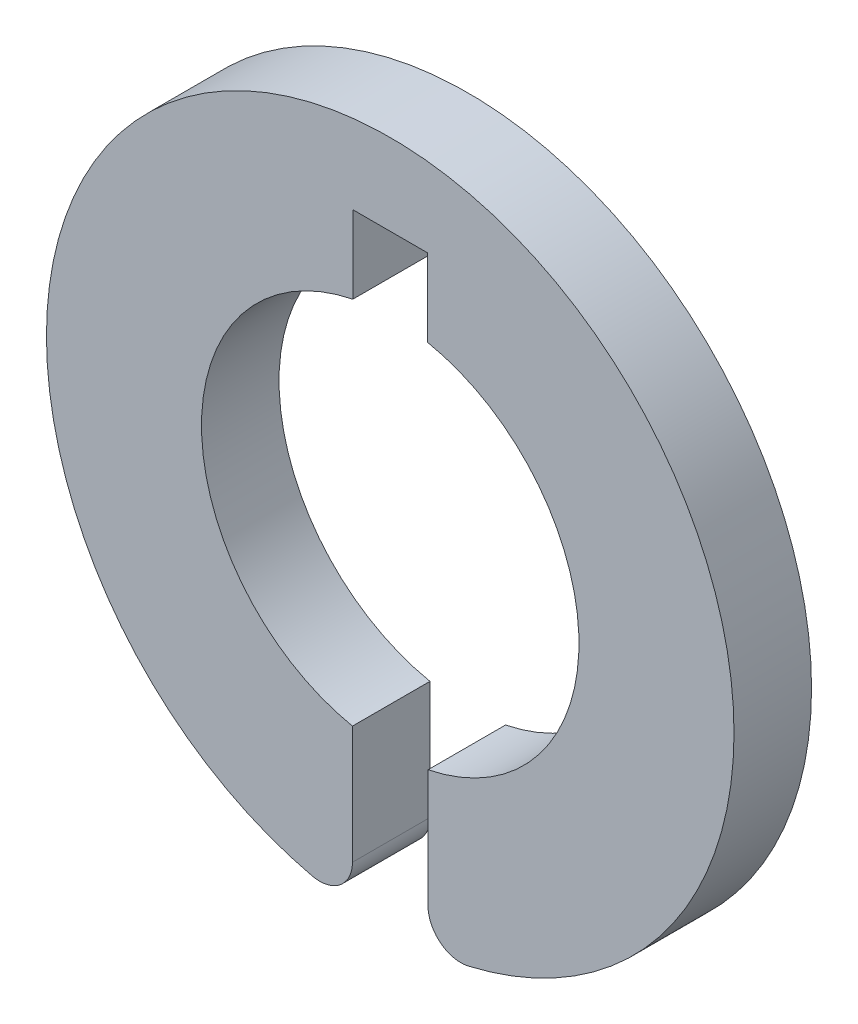
from build123d import *

# Parameters (mm, degrees)
EXTRUDE_1_DEPTH = 3
FILLET_1_R      = 1.27


with BuildPart() as part:
    # 스케치1 → 보스-돌출1 (new body)
    with BuildSketch(Plane.XY):
        with BuildLine():
            Line((-1.4475, 10.157600855), (1.4475, 10.157600855))
            Line((1.4475, 10.157600855), (1.4475, 7.157600855))
            ThreePointArc((1.4475, 7.157600855), (7.302495989, 0.007653457), (1.4625, -7.154550999))
            Line((1.4625, -7.154550999), (1.4625, -13.221860686))
            ThreePointArc((1.4625, -13.221860686), (0, 13.3025), (-1.4625, -13.221860686))
            Line((-1.4625, -13.221860686), (-1.4625, -7.154550999))
            ThreePointArc((-1.4625, -7.154550999), (-7.302495989, 0.007653457), (-1.4475, 7.157600855))
            Line((-1.4475, 7.157600855), (-1.4475, 10.157600855))
        make_face()
    extrude(amount=EXTRUDE_1_DEPTH)

    # 필렛1
    fillet_1_edges = [part.edges().sort_by_distance(p)[0] for p in [
        (-1.4625, -13.221860686, 1.5),
        (1.4625, -13.221860686, 1.5),
    ]]
    fillet(fillet_1_edges, radius=FILLET_1_R)


solid = part.part
